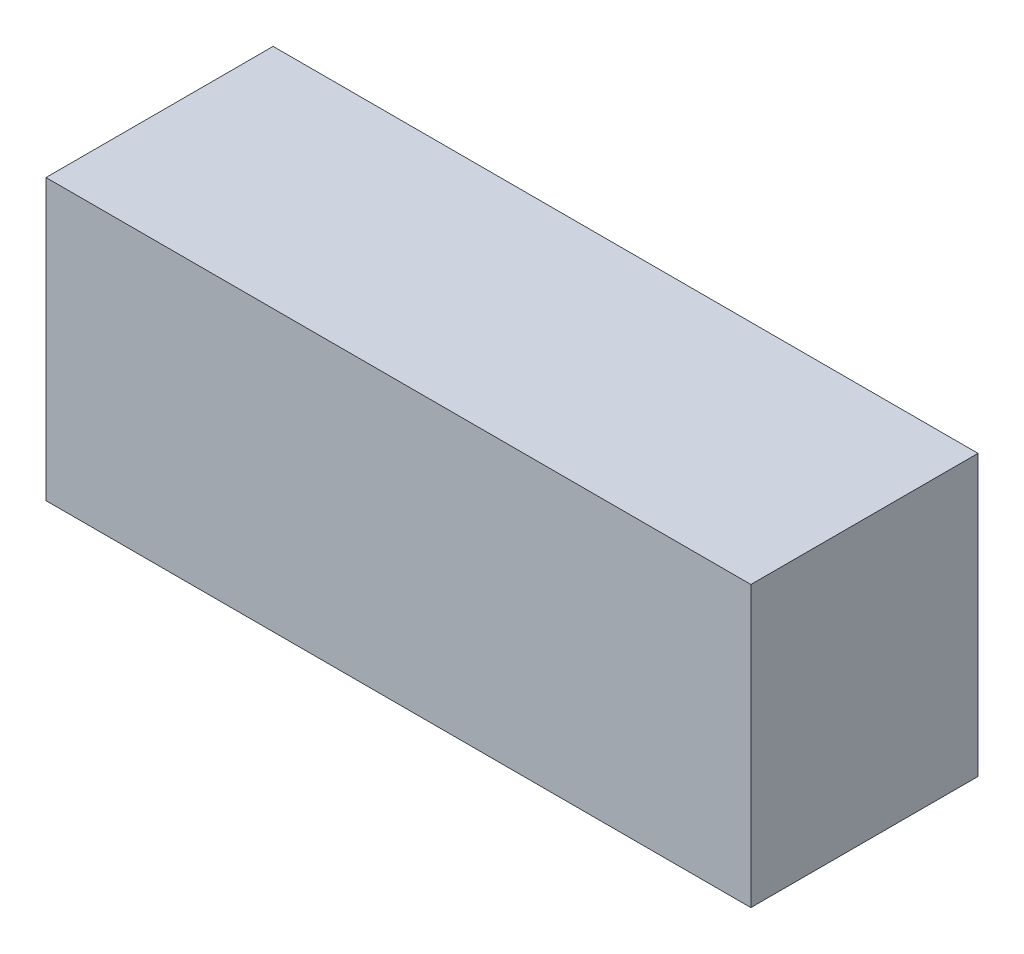
from build123d import *

# Parameters (mm, degrees)
SKETCH1_W           = 135
SKETCH1_H           = 43.5
BOSS_EXTRUDE1_DEPTH = 53.6


with BuildPart() as part:
    # Sketch1 → Boss-Extrude1 (new body)
    with BuildSketch(Plane(origin=(0, 0, 0), x_dir=(1, 0, 0), z_dir=(0, 1, 0))):
        Rectangle(SKETCH1_W, SKETCH1_H)
    extrude(amount=BOSS_EXTRUDE1_DEPTH)


solid = part.part
